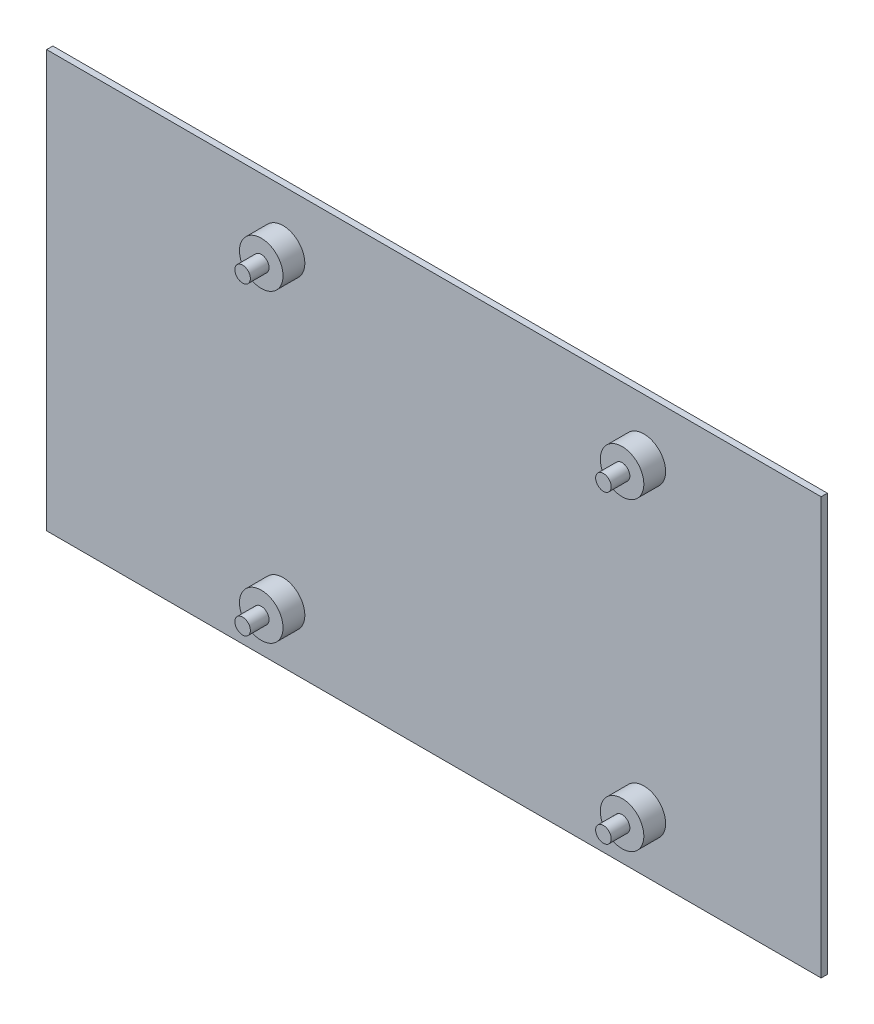
from build123d import *

# Parameters (mm, degrees)
SKETCH1_W           = 124.5
SKETCH1_H           = 67
BOSS_EXTRUDE1_DEPTH = 1
SKETCH2_R           = 3.5
BOSS_EXTRUDE2_DEPTH = 3.5
SKETCH3_R           = 1.25
BOSS_EXTRUDE3_DEPTH = 3


with BuildPart() as part:
    # Sketch1 → Boss-Extrude1 (new body)
    with BuildSketch(Plane.XY):
        Rectangle(SKETCH1_W, SKETCH1_H)
    extrude(amount=BOSS_EXTRUDE1_DEPTH)

    # Sketch2 → Boss-Extrude2 (add)
    with BuildSketch(Plane.XY.offset(1)):
        with Locations(Location((-24.25, 24.5, 0), (0, 0, 180))):
            Circle(SKETCH2_R)
        with Locations(Location((33.75, 24.5, 0), (0, 0, 180))):
            Circle(SKETCH2_R)
        with Locations(Location((33.75, -24.5, 0), (0, 0, 180))):
            Circle(SKETCH2_R)
        with Locations(Location((-24.25, -24.5, 0), (0, 0, 180))):
            Circle(SKETCH2_R)
    extrude(amount=BOSS_EXTRUDE2_DEPTH)

    # Sketch3 → Boss-Extrude3 (add)
    with BuildSketch(Plane.XY.offset(4.5)):
        with Locations((-24.25, 24.5)):
            Circle(SKETCH3_R)
        with Locations((33.75, 24.5)):
            Circle(SKETCH3_R)
        with Locations((33.75, -24.5)):
            Circle(SKETCH3_R)
        with Locations((-24.25, -24.5)):
            Circle(SKETCH3_R)
    extrude(amount=BOSS_EXTRUDE3_DEPTH)


solid = part.part
